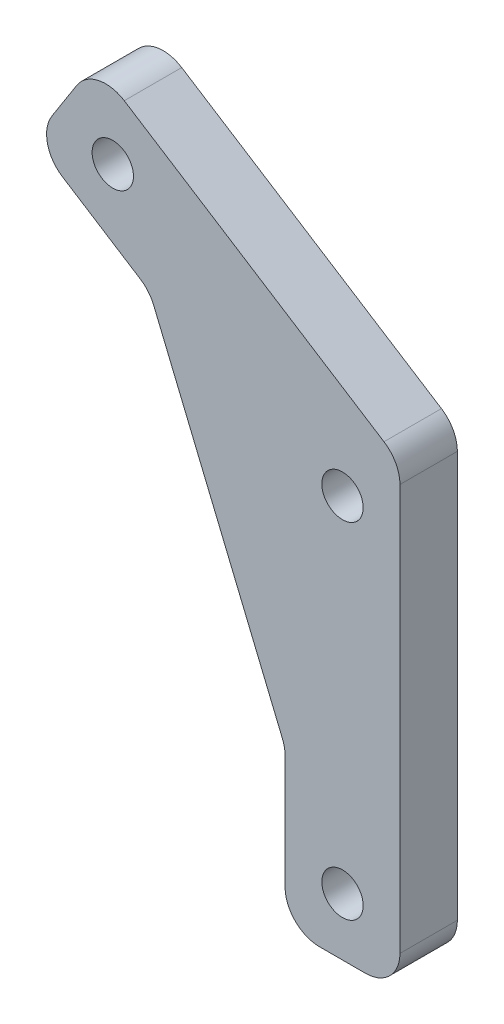
from build123d import *

# Parameters (mm, degrees)
SKETCH1_R           = 2.286
BOSS_EXTRUDE1_DEPTH = 6.35
CHAMFER1_SIZE       = 17.78
CHAMFER1_SIZE2      = 26.652616032
FILLET1_R           = 3.81


with BuildPart() as part:
    # Sketch1 → Boss-Extrude1 (new body)
    with BuildSketch(Plane.XY):
        Polygon((-34.167492812, 55.206788795), (-6.35, 37.482986116), (-6.35, -6.35), (6.35, -6.35), (6.35, 44.45), (-27.343211205, 65.917492812), align=None)
        Circle(SKETCH1_R, mode=Mode.SUBTRACT)
        with Locations((0, 38.1)):
            Circle(SKETCH1_R, mode=Mode.SUBTRACT)
        with Locations((-25.4, 57.15)):
            Circle(SKETCH1_R, mode=Mode.SUBTRACT)
    extrude(amount=BOSS_EXTRUDE1_DEPTH)

    # Chamfer1
    chamfer1_edges = [part.edges().sort_by_distance(p)[0] for p in [
        (-6.35, 37.482986116, 3.175),
    ]]
    chamfer1_side = [part.faces().sort_by_distance(p)[0] for p in [
        (-20.258746406, 46.344887456, 3.175),
    ]]
    chamfer(chamfer1_edges, length=CHAMFER1_SIZE, length2=CHAMFER1_SIZE2, reference=chamfer1_side[0])

    # Fillet1
    fillet1_edges = [part.edges().sort_by_distance(p)[0] for p in [
        (-27.343211205, 65.917492812, 3.175),
        (6.35, 44.45, 3.175),
        (6.35, -6.35, 3.175),
        (-6.35, -6.35, 3.175),
        (-34.167492812, 55.206788795, 3.175),
        (-6.35, 10.830370085, 3.175),
        (-21.344985624, 47.036980366, 3.175),
    ]]
    fillet(fillet1_edges, radius=FILLET1_R)


solid = part.part
